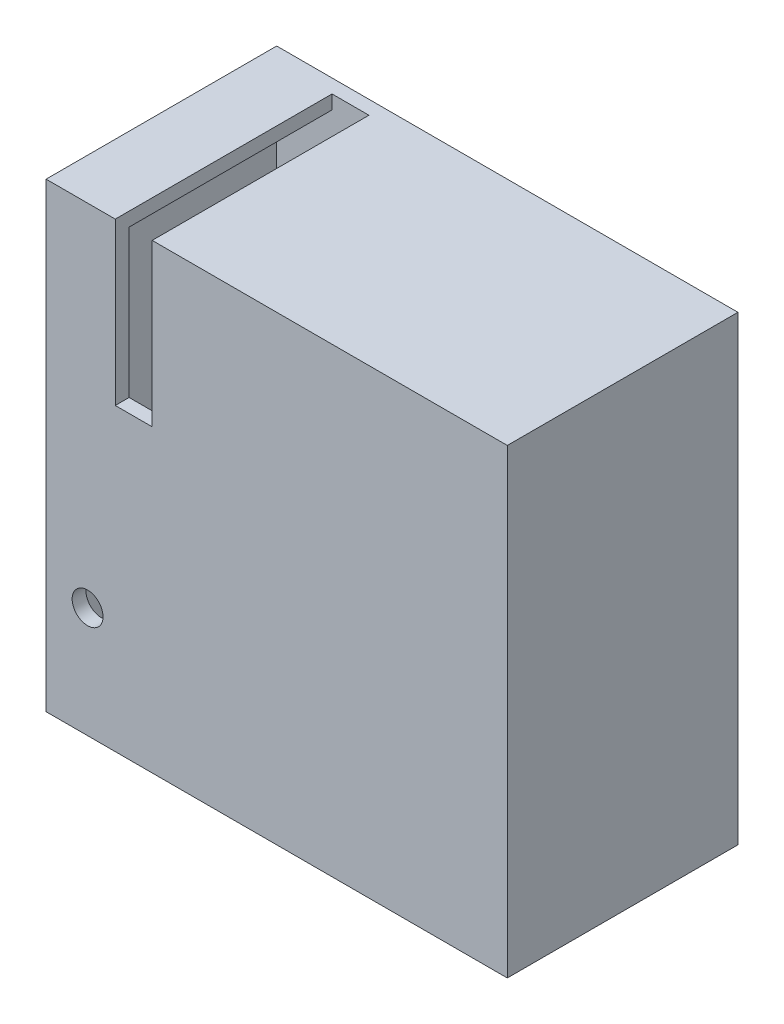
from build123d import *

# Parameters (mm, degrees)
SKETCH1_W           = 100
SKETCH1_H           = 100
BOSS_EXTRUDE2_DEPTH = 50
SKETCH3_W           = 8
SKETCH3_H           = 35
CUT_EXTRUDE2_DEPTH  = 47
SKETCH4_W           = 94
SKETCH4_H           = 44
CUT_EXTRUDE3_DEPTH  = 97
CUT_EXTRUDE4_REACH  = 152
SKETCH5_W           = 12
SKETCH5_H           = 8
CUT_EXTRUDE5_REACH  = 152
SKETCH6_R           = 3.35


with BuildPart() as part:
    # Sketch1 → Boss-Extrude2 (new body)
    with BuildSketch(Plane.XY):
        with Locations((50, 50)):
            Rectangle(SKETCH1_W, SKETCH1_H)
    extrude(amount=-BOSS_EXTRUDE2_DEPTH)

    # Sketch3 → Cut-Extrude2 (cut)
    with BuildSketch(Plane.XY):
        with Locations((19, 82.5)):
            Rectangle(SKETCH3_W, SKETCH3_H)
    extrude(amount=-CUT_EXTRUDE2_DEPTH, mode=Mode.SUBTRACT)

    # Sketch4 → Cut-Extrude3 (cut)
    with BuildSketch(Plane.XZ):
        with Locations((50, -25)):
            Rectangle(SKETCH4_W, SKETCH4_H)
    extrude(amount=-CUT_EXTRUDE3_DEPTH, mode=Mode.SUBTRACT)

    # Sketch5 → Cut-Extrude4 (cut, up to next)
    with BuildSketch(Plane.ZY, mode=Mode.PRIVATE) as cut_extrude4_sk1:
        with Locations((-25, 24)):
            Rectangle(SKETCH5_W, SKETCH5_H)
    cut_extrude4_tool1 = extrude(cut_extrude4_sk1.sketch, amount=-CUT_EXTRUDE4_REACH, mode=Mode.PRIVATE) & part.part
    add(cut_extrude4_tool1.solids().sort_by_distance((0, 24, -25))[0], mode=Mode.SUBTRACT)

    # Sketch6 → Cut-Extrude5 (cut, up to next)
    with BuildSketch(Plane.XY, mode=Mode.PRIVATE) as cut_extrude5_sk1:
        with Locations((9, 24)):
            Circle(SKETCH6_R)
    cut_extrude5_tool1 = extrude(cut_extrude5_sk1.sketch, amount=-CUT_EXTRUDE5_REACH, mode=Mode.PRIVATE) & part.part
    add(cut_extrude5_tool1.solids().sort_by_distance((9, 24, 0))[0], mode=Mode.SUBTRACT)


solid = part.part
